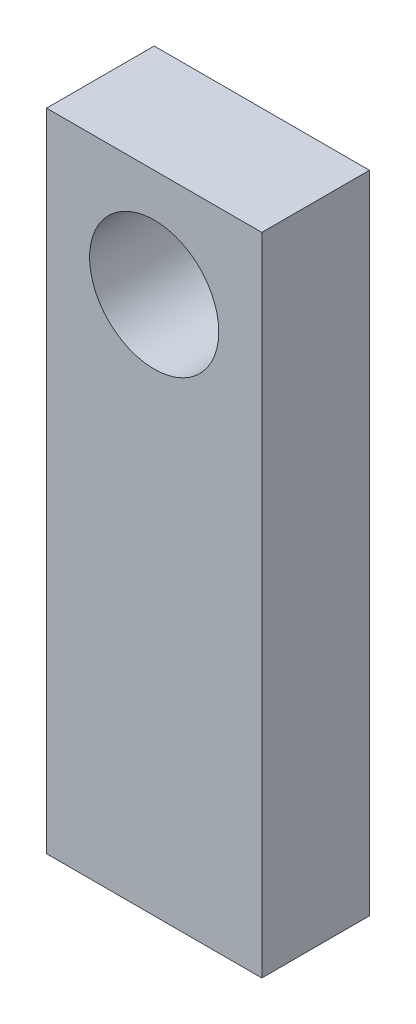
from build123d import *

# Parameters (mm, degrees)
SKETCH1_W               = 12.7
SKETCH1_H               = 38.1
BOSS_EXTRUDE1_DEPTH     = 6.35
CUT_EXTRUDE1_DEPTH      = 41.659838908
CUT_EXTRUDE1_DEPTH_BACK = 41.659838908
SKETCH2_R               = 3.81


with BuildPart() as part:
    # Sketch1 → Boss-Extrude1 (new body)
    with BuildSketch(Plane.XY):
        with Locations((6.35, -19.05)):
            Rectangle(SKETCH1_W, SKETCH1_H)
    extrude(amount=BOSS_EXTRUDE1_DEPTH)

    # Sketch2 → Cut-Extrude1 (cut, two sides: drawn at the far end of the back side and taken through both)
    with BuildSketch(Plane.XY.offset(6.35).offset(-CUT_EXTRUDE1_DEPTH_BACK)):
        with Locations((6.35, -6.35)):
            Circle(SKETCH2_R)
    extrude(amount=CUT_EXTRUDE1_DEPTH + CUT_EXTRUDE1_DEPTH_BACK, mode=Mode.SUBTRACT)


solid = part.part
